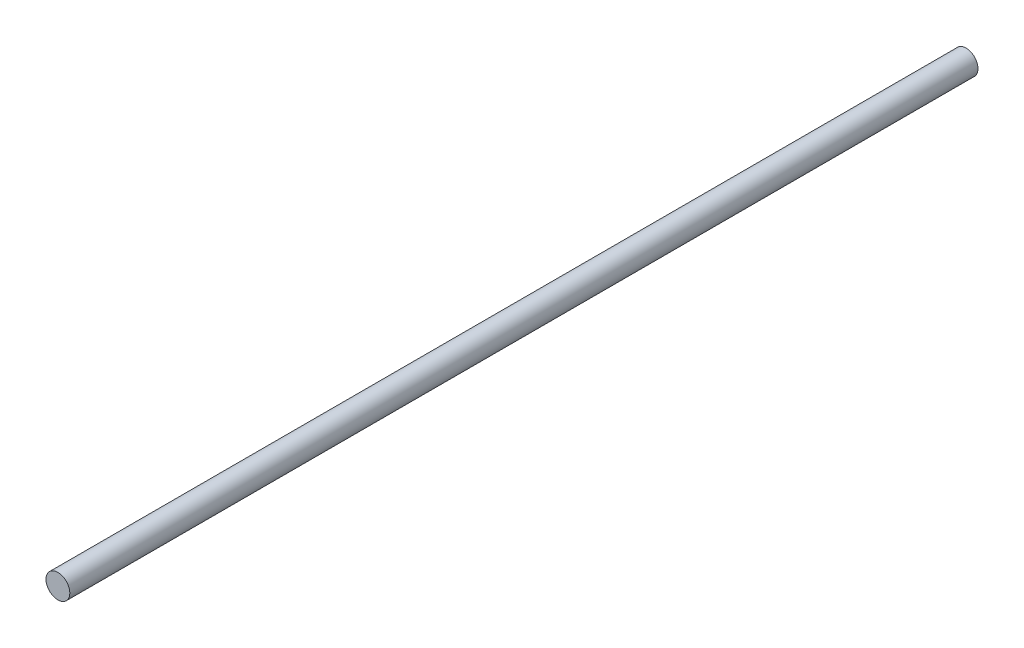
from build123d import *

# Parameters (mm, degrees)
BOSS_EXTRUDE1_DEPTH      = 152.4
BOSS_EXTRUDE1_DEPTH_BACK = 152.4
SKETCH3_R                = 4


with BuildPart() as part:
    # Sketch3 → Boss-Extrude1 (new, two sides: drawn at the far end of the back side and taken through both)
    with BuildSketch(Plane.XY.offset(-BOSS_EXTRUDE1_DEPTH_BACK)):
        Circle(SKETCH3_R)
    extrude(amount=BOSS_EXTRUDE1_DEPTH + BOSS_EXTRUDE1_DEPTH_BACK)


solid = part.part
